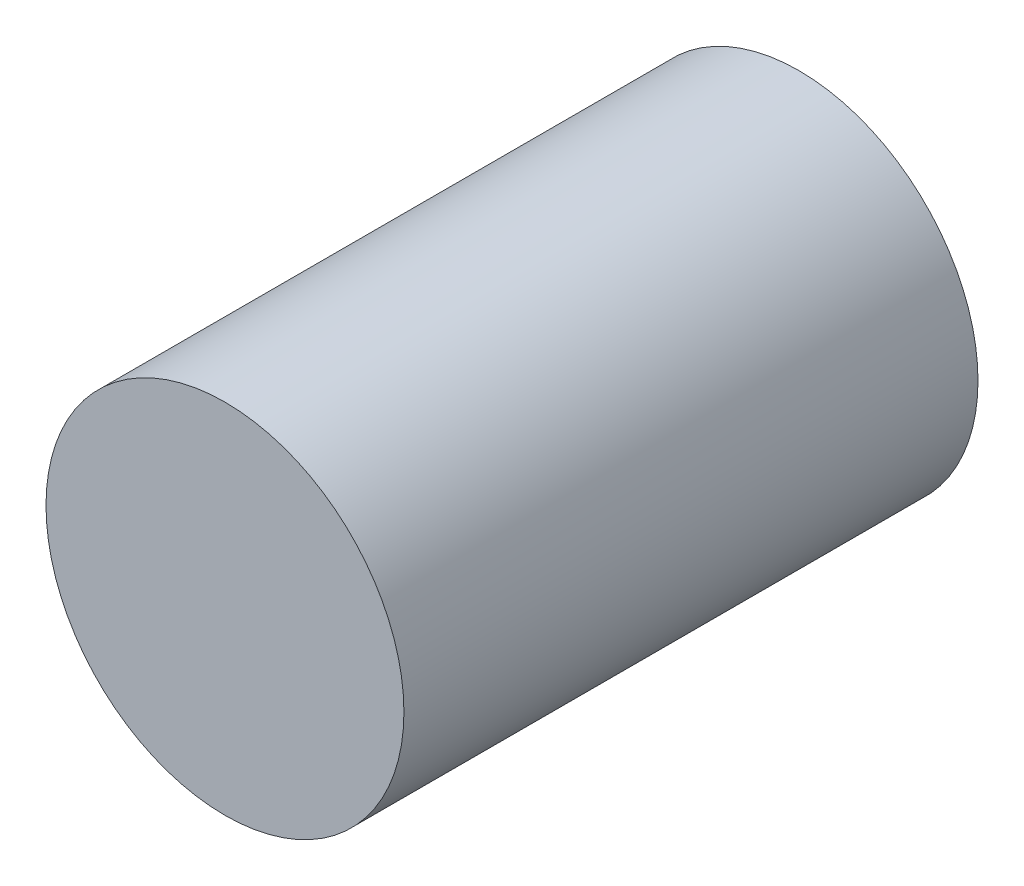
from build123d import *

# Parameters (mm, degrees)
SKETCH_1_R      = 0.311736685
EXTRUDE_1_DEPTH = 0.5


with BuildPart() as part:
    # 草图1 → 凸台-拉伸1 (new, symmetric)
    with BuildSketch(Plane.XY):
        with Locations((-1, 0)):
            Circle(SKETCH_1_R)
    extrude(amount=EXTRUDE_1_DEPTH, both=True)


solid = part.part
